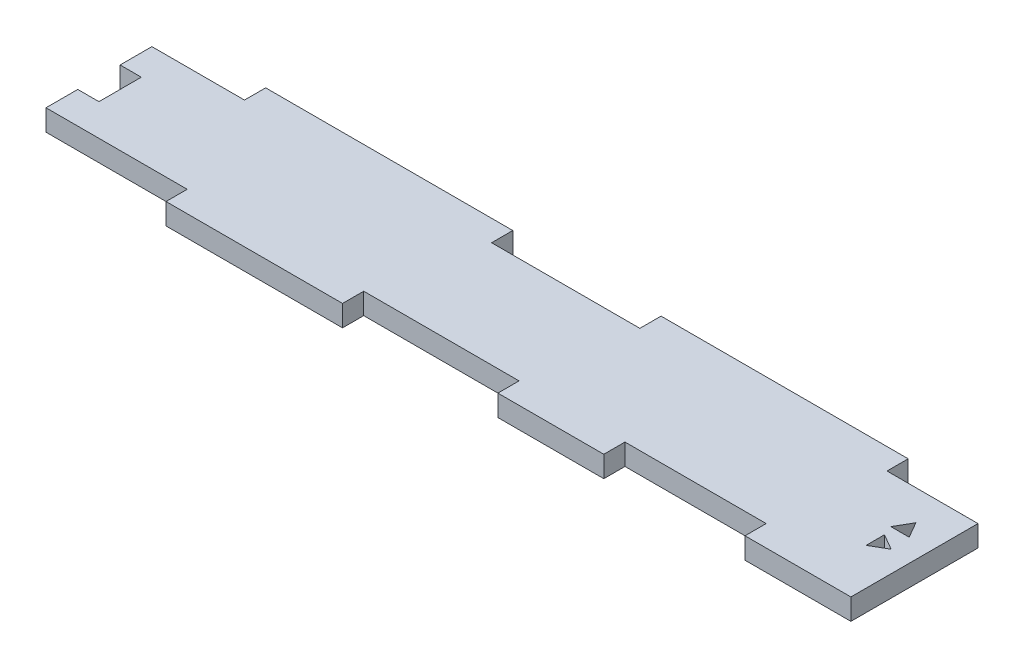
from build123d import *

# Parameters (mm, degrees)
SKETCH1_W                = 117
SKETCH1_H                = 15
BOSS_EXTRUDE1_DEPTH      = 1.5
SKETCH2_W                = 15
SKETCH2_H                = 3
BOSS_EXTRUDE2_DEPTH      = 1.5
SKETCH12_W               = 25
SKETCH12_H               = 3
BOSS_EXTRUDE3_DEPTH      = 1.5
SKETCH13_W               = 35
SKETCH13_H               = 3
BOSS_EXTRUDE4_DEPTH      = 1.5
CUT_EXTRUDE10_DEPTH      = 60.453763548
CUT_EXTRUDE10_DEPTH_BACK = 60.453763548
CUT_EXTRUDE11_DEPTH      = 60.453763548
CUT_EXTRUDE11_DEPTH_BACK = 60.453763548
SKETCH16_W               = 3
SKETCH16_H               = 6


with BuildPart() as part:
    # Sketch1 → Boss-Extrude1 (new, symmetric)
    with BuildSketch(Plane(origin=(0, 0, 0), x_dir=(1, 0, 0), z_dir=(0, 1, 0))):
        Rectangle(SKETCH1_W, SKETCH1_H)
    extrude(amount=BOSS_EXTRUDE1_DEPTH, both=True)

    # Sketch2 → Boss-Extrude2 (add, symmetric)
    with BuildSketch(Plane(origin=(0, 0, 0), x_dir=(1, 0, 0), z_dir=(0, 1, 0))):
        with Locations((16, -9)):
            Rectangle(SKETCH2_W, SKETCH2_H)
        with Locations((51, -9)):
            Rectangle(SKETCH2_W, SKETCH2_H)
    extrude(amount=BOSS_EXTRUDE2_DEPTH, both=True)

    # Sketch12 → Boss-Extrude3 (add, symmetric)
    with BuildSketch(Plane(origin=(0, 0, 0), x_dir=(1, 0, 0), z_dir=(0, 1, 0))):
        with Locations((-26, -9)):
            Rectangle(SKETCH12_W, SKETCH12_H)
    extrude(amount=BOSS_EXTRUDE3_DEPTH, both=True)

    # Sketch13 → Boss-Extrude4 (add, symmetric)
    with BuildSketch(Plane(origin=(0, 0, 0), x_dir=(1, 0, 0), z_dir=(0, 1, 0))):
        with Locations((-27.89, 9)):
            Rectangle(SKETCH13_W, SKETCH13_H)
        with Locations((28.11, 9)):
            Rectangle(SKETCH13_W, SKETCH13_H)
    extrude(amount=BOSS_EXTRUDE4_DEPTH, both=True)

    # Sketch15 → Cut-Extrude10 (cut, two sides: drawn at the far end of the back side and taken through both)
    with BuildSketch(Plane(origin=(0, 0, 0), x_dir=(1, 0, 0), z_dir=(0, 1, 0)).offset(-CUT_EXTRUDE10_DEPTH_BACK)):
        Polygon((55.5, -1.799038106), (53.25, -0.5), (53.25, -3.098076211), align=None)
        Polygon((54, 3.202955396), (52.700961894, 0.952955396), (55.299038106, 0.952955396), align=None)
    extrude(amount=CUT_EXTRUDE10_DEPTH + CUT_EXTRUDE10_DEPTH_BACK, mode=Mode.SUBTRACT)

    # Sketch16 → Cut-Extrude11 (cut, two sides: drawn at the far end of the back side and taken through both)
    with BuildSketch(Plane(origin=(0, 0, 0), x_dir=(1, 0, 0), z_dir=(0, 1, 0)).offset(-CUT_EXTRUDE11_DEPTH_BACK)):
        with Locations((-57, 0)):
            Rectangle(SKETCH16_W, SKETCH16_H)
    extrude(amount=CUT_EXTRUDE11_DEPTH + CUT_EXTRUDE11_DEPTH_BACK, mode=Mode.SUBTRACT)


solid = part.part
